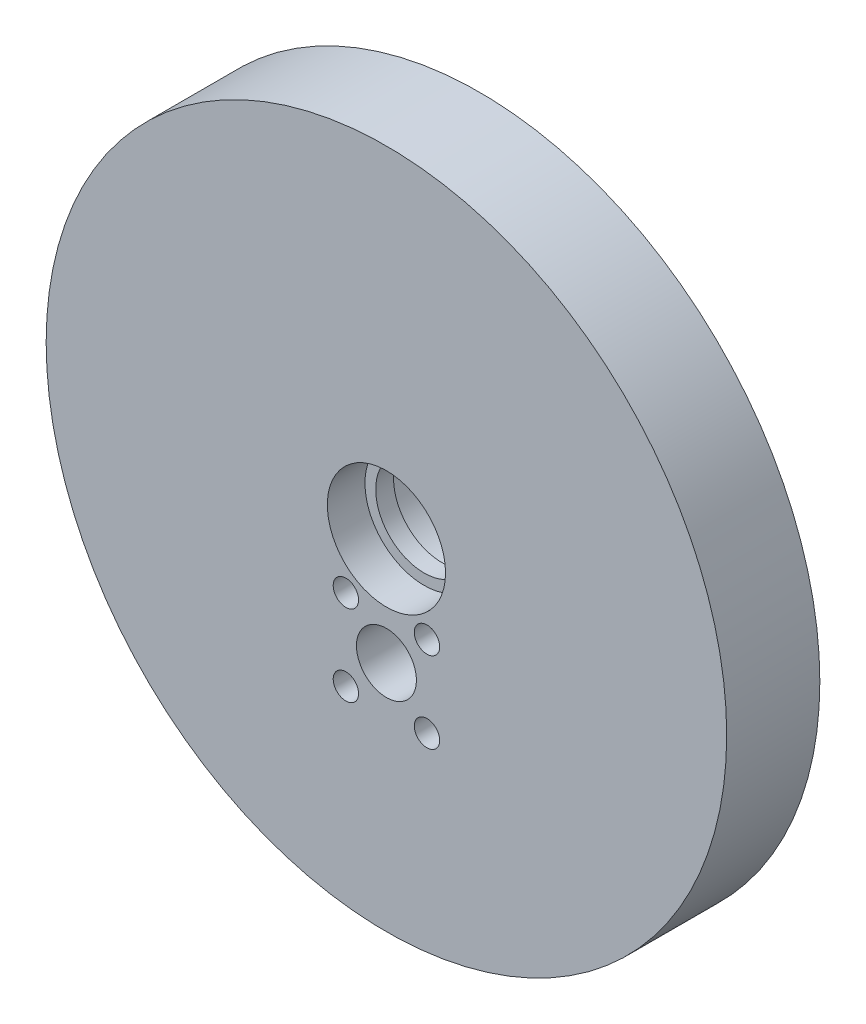
from build123d import *

# Parameters (mm, degrees)
SKETCH1_R           = 48.26
BOSS_EXTRUDE1_DEPTH = 13.208
SKETCH2_R           = 8.382
CUT_EXTRUDE1_DEPTH  = 5.334
SKETCH12_R          = 4.25
CUT_EXTRUDE5_DEPTH  = 70.516231659
SKETCH13_R          = 1.8
CUT_EXTRUDE7_DEPTH  = 70.516231659
SKETCH14_R          = 6.858
CUT_EXTRUDE8_DEPTH  = 70.516231659


with BuildPart() as part:
    # Sketch1 → Boss-Extrude1 (new body)
    with BuildSketch(Plane.XY):
        with Locations(Location((0, 0, 0), (0, 0, 180))):
            Circle(SKETCH1_R)
    extrude(amount=BOSS_EXTRUDE1_DEPTH)

    # Sketch2 → Cut-Extrude1 (cut)
    with BuildSketch(Plane.XY.offset(13.208)):
        Circle(SKETCH2_R)
    cut_extrude1 = extrude(amount=-CUT_EXTRUDE1_DEPTH, mode=Mode.SUBTRACT)

    # Sketch12 → Cut-Extrude5 (cut, through all)
    with BuildSketch(Plane(origin=(0, 0, 0), x_dir=(-1, 0, 0), z_dir=(0, 0, -1))):
        with Locations((0, -15.24)):
            Circle(SKETCH12_R)
    extrude(amount=-CUT_EXTRUDE5_DEPTH, mode=Mode.SUBTRACT)

    # Sketch13 → Cut-Extrude7 (cut, through all)
    with BuildSketch(Plane(origin=(0, 0, 0), x_dir=(-1, 0, 0), z_dir=(0, 0, -1))):
        with Locations((5.75, -9.49)):
            Circle(SKETCH13_R)
        with Locations((5.75, -20.99)):
            Circle(SKETCH13_R)
        with Locations((-5.75, -20.99)):
            Circle(SKETCH13_R)
        with Locations((-5.75, -9.49)):
            Circle(SKETCH13_R)
    extrude(amount=-CUT_EXTRUDE7_DEPTH, mode=Mode.SUBTRACT)

    # Mirror1: Cut-Extrude1 across plane
    add(cut_extrude1.mirror(Plane.XY.offset(6.604)), mode=Mode.SUBTRACT)

    # Sketch14 → Cut-Extrude8 (cut, through all)
    with BuildSketch(Plane.XY.offset(13.208)):
        Circle(SKETCH14_R)
    extrude(amount=-CUT_EXTRUDE8_DEPTH, mode=Mode.SUBTRACT)


solid = part.part
